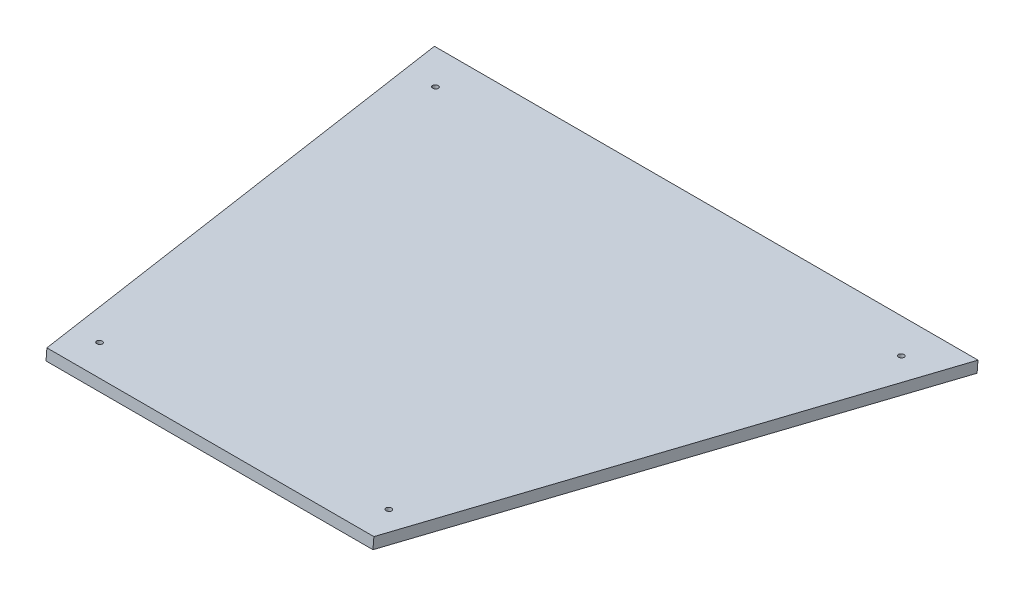
from build123d import *

# Parameters (mm, degrees)
BOSS_EXTRUDE1_DEPTH = 12.7
SKETCH2_R           = 3.175000002
CUT_EXTRUDE1_DEPTH  = 2375.892579794


with BuildPart() as part:
    # Sketch1 → Boss-Extrude1 (new body)
    with BuildSketch(Plane(origin=(-0.000661708, -8255.328766721, 681.010699718), x_dir=(-0.9999999999999969, 7.961414168714261e-08, -6.567661367452003e-09), z_dir=(-7.988457756299225e-08, -0.996614682353027, 0.08221420143970737))):
        Polygon((927.932358973, -1893.28840213), (1306.839320092, -1893.28840213), (1432.35206282, -1316.739819062), (802.419616245, -1316.739819062), align=None)
    extrude(amount=BOSS_EXTRUDE1_DEPTH)

    # Sketch2 → Cut-Extrude1 (cut, through all)
    with BuildSketch(Plane(origin=(-0.000661714, -8255.328766721, 681.010699718), x_dir=(0.9999999999999968, -7.961414422751635e-08, 6.5676468617910225e-09), z_dir=(7.988457890219468e-08, 0.9966146823530272, -0.08221420143970452))):
        with Locations(Location((-1284.956595837, -1854.019614904, 0), (0, 0, 270))):
            Circle(SKETCH2_R)
        with Locations(Location((-949.797461581, -1853.938669103, 0), (0, 0, 270))):
            Circle(SKETCH2_R)
        with Locations(Location((-1387.301054815, -1360.701208825, 0), (0, 0, 270))):
            Circle(SKETCH2_R)
        with Locations(Location((-847.47062424, -1360.701208825, 0), (0, 0, 270))):
            Circle(SKETCH2_R)
    extrude(amount=-CUT_EXTRUDE1_DEPTH, mode=Mode.SUBTRACT)


solid = part.part
